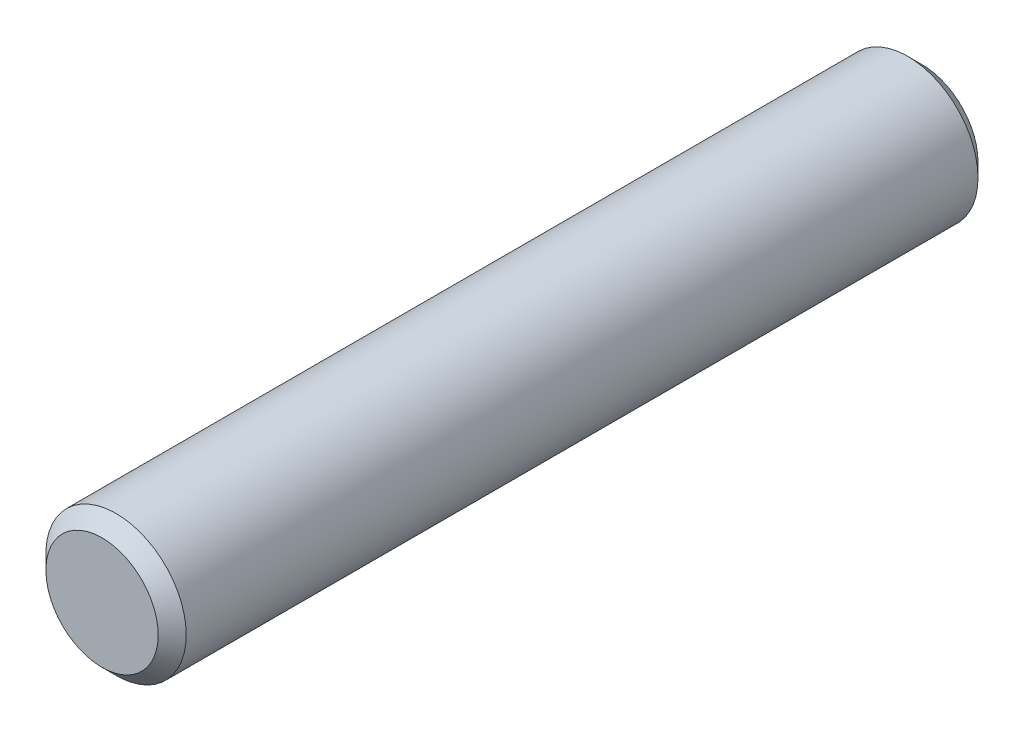
from build123d import *

# Parameters (mm, degrees)
SKETCH1_R      = 4
EXTRUDE1_DEPTH = 23.368
CHAMFER1_SIZE  = 0.8


with BuildPart() as part:
    # Sketch1 → Extrude1 (new, symmetric)
    with BuildSketch(Plane.XY):
        Circle(SKETCH1_R)
    extrude(amount=EXTRUDE1_DEPTH, both=True)

    # Chamfer1
    chamfer1_edges = [part.edges().sort_by_distance(p)[0] for p in [
        (-4, 0, -23.368),
        (-4, 0, 23.368),
    ]]
    chamfer(chamfer1_edges, length=CHAMFER1_SIZE)


solid = part.part
